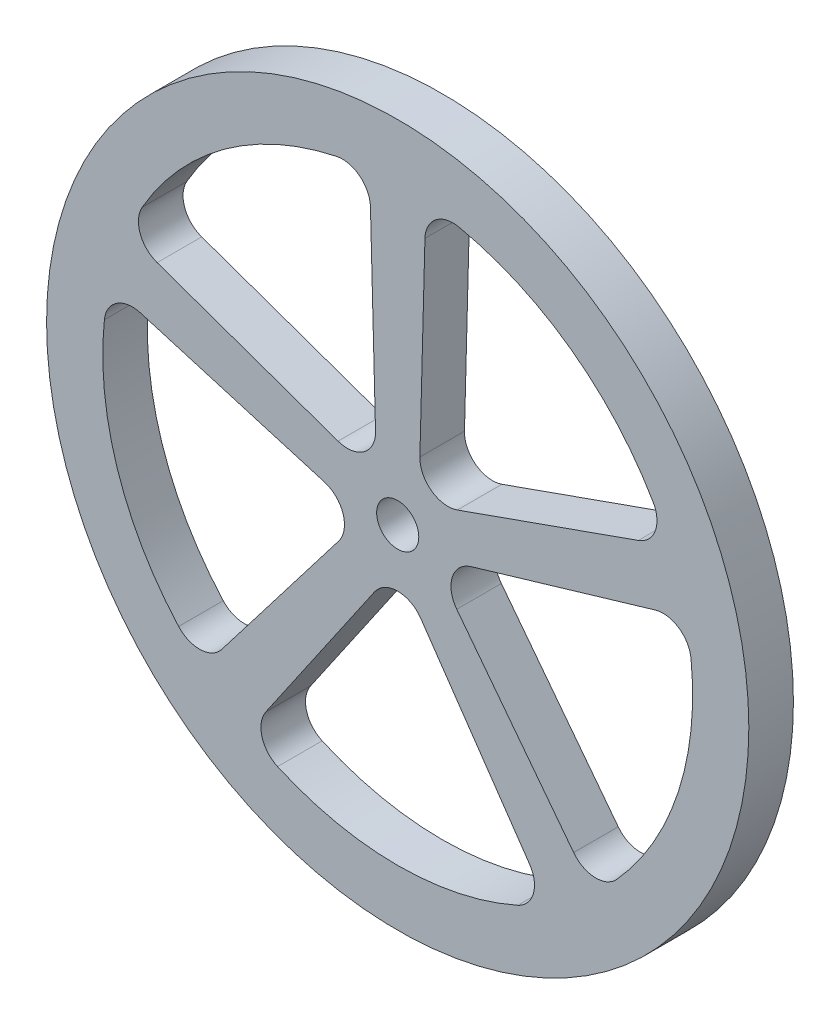
from build123d import *

# Parameters (mm, degrees)
SKETCH1_R             = 25
SKETCH1_R_2           = 21
BOSS_EXTRUDE1_DEPTH   = 3.175
SKETCH1_R_3           = 2.5
SKETCH1_R_4           = 1.5
BOSS_EXTRUDE1_2_DEPTH = 3.175
BOSS_EXTRUDE2_DEPTH   = 3.175
CIRPATTERN1_COUNT     = 5
FILLET1_R             = 2
FILLET2_R             = 2


with BuildPart() as part:
    # Sketch1 → Boss-Extrude1 (new body)
    with BuildSketch(Plane.XY):
        Circle(SKETCH1_R)
        Circle(SKETCH1_R_2, mode=Mode.SUBTRACT)
    extrude(amount=BOSS_EXTRUDE1_DEPTH)



with BuildPart() as body_2:
    # Sketch1 → Boss-Extrude1 2 (new body)
    with BuildSketch(Plane.XY):
        Circle(SKETCH1_R_3)
        Circle(SKETCH1_R_4, mode=Mode.SUBTRACT)
    extrude(amount=BOSS_EXTRUDE1_2_DEPTH)


with BuildPart() as part_1:
    add(part.part)

    add(body_2.part)  # Boss-Extrude2 merges body 2
    # Sketch2 → Boss-Extrude2 (add)
    with BuildSketch(Plane.XY):
        with BuildLine():
            ThreePointArc((-1.5, 2), (-0.790569415, 2.371708245), (0, 2.5))
            Line((0, 2.5), (0, 21))
            ThreePointArc((0, 21), (-1.00113831, 20.976122666), (-2, 20.90454496))
            Line((-2, 20.90454496), (-1.5, 2))
        make_face()
        with BuildLine():
            Line((0, 21), (0, 2.5))
            ThreePointArc((0, 2.5), (0.790569415, 2.371708245), (1.5, 2))
            Line((1.5, 2), (2, 20.90454496))
            ThreePointArc((2, 20.90454496), (1.00113831, 20.976122666), (0, 21))
        make_face()
    boss_extrude2 = extrude(amount=BOSS_EXTRUDE2_DEPTH)

    # CirPattern1: Boss-Extrude2 ×5 about axis
    cirpattern1_axis = Axis((0, 0, 0), (0, 0, 1))
    for i in range(1, CIRPATTERN1_COUNT):
        add(boss_extrude2.rotate(cirpattern1_axis, i * 360 / CIRPATTERN1_COUNT))

    # Fillet1
    fillet1_edges = [part_1.edges().sort_by_distance(p)[0] for p in [
        (1.501772388, 2.067012363, 1.5875),
        (-1.501772388, 2.067012363, 1.5875),
        (-2.429918767, -0.789528467, 1.5875),
        (0, -2.554967791, 1.5875),
        (2.429918767, -0.789528467, 1.5875),
    ]]
    fillet(fillet1_edges, radius=FILLET1_R)

    # Fillet2
    fillet2_edges = [part_1.edges().sort_by_distance(p)[0] for p in [
        (-2, 20.90454496, 1.5875),
        (2, 20.90454496, 1.5875),
        (19.263369716, 8.361972685, 1.5875),
        (-20.499437693, 4.55774662, 1.5875),
        (-19.263369716, 8.361972685, 1.5875),
        (-10.669349245, -18.087702637, 1.5875),
        (-13.905417222, -15.736561628, 1.5875),
        (13.905417222, -15.736561628, 1.5875),
        (10.669349245, -18.087702637, 1.5875),
        (20.499437693, 4.55774662, 1.5875),
    ]]
    fillet(fillet2_edges, radius=FILLET2_R)


solid = part_1.part
